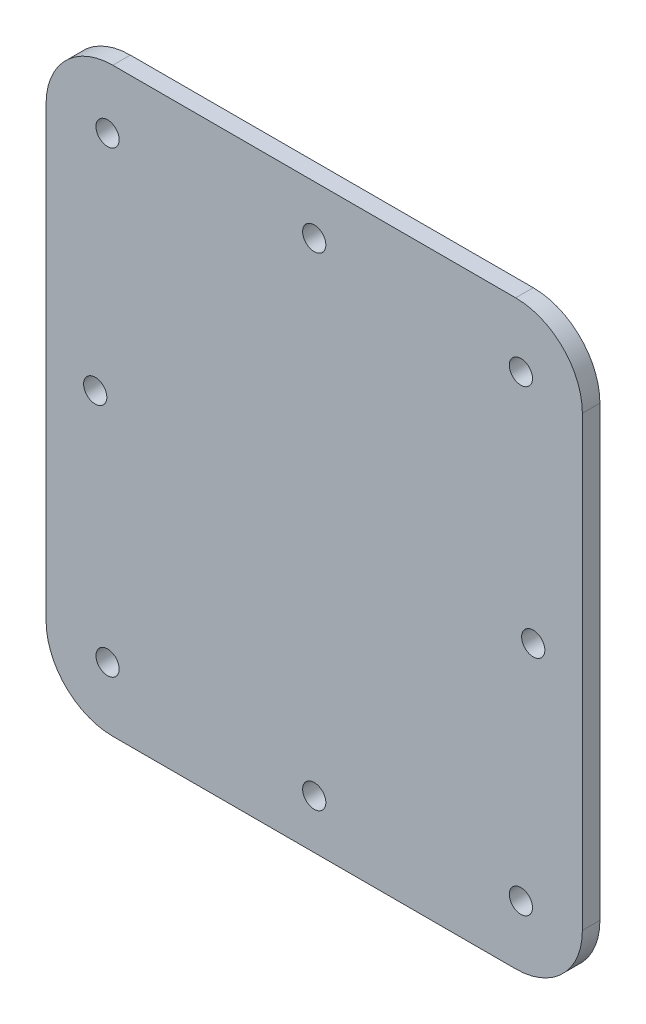
from build123d import *

# Parameters (mm, degrees)
SKETCH1_R           = 2.1
BOSS_EXTRUDE1_DEPTH = 3.175


with BuildPart() as part:
    # Sketch1 → Boss-Extrude1 (new body)
    with BuildSketch(Plane.XY):
        with BuildLine():
            Line((88.518997498, 156.463994751), (15.620999985, 156.463994751))
            ThreePointArc((15.620999985, 156.463994751), (7.08975667, 152.930238066), (3.555999985, 144.398994751))
            Line((3.555999985, 144.398994751), (3.555999985, 63.373000793))
            ThreePointArc((3.555999985, 63.373000793), (7.08975667, 54.841757478), (15.620999985, 51.308000793))
            Line((15.620999985, 51.308000793), (88.518997498, 51.308000793))
            ThreePointArc((88.518997498, 51.308000793), (97.050240813, 54.841757478), (100.583997498, 63.373000793))
            Line((100.583997498, 63.373000793), (100.583997498, 144.398994751))
            ThreePointArc((100.583997498, 144.398994751), (97.050240813, 152.930238066), (88.518997498, 156.463994751))
        make_face()
        with Locations((14.677846312, 145.342148424)):
            Circle(SKETCH1_R, mode=Mode.SUBTRACT)
        with Locations((52.069998741, 147.573994751)):
            Circle(SKETCH1_R, mode=Mode.SUBTRACT)
        with Locations((89.46215117, 145.342148424)):
            Circle(SKETCH1_R, mode=Mode.SUBTRACT)
        with Locations((91.693997498, 103.885997772)):
            Circle(SKETCH1_R, mode=Mode.SUBTRACT)
        with Locations((89.46215117, 62.429847121)):
            Circle(SKETCH1_R, mode=Mode.SUBTRACT)
        with Locations((52.069998741, 60.198000793)):
            Circle(SKETCH1_R, mode=Mode.SUBTRACT)
        with Locations((14.677846312, 62.429847121)):
            Circle(SKETCH1_R, mode=Mode.SUBTRACT)
        with Locations((12.445999985, 103.885997772)):
            Circle(SKETCH1_R, mode=Mode.SUBTRACT)
    extrude(amount=BOSS_EXTRUDE1_DEPTH)


solid = part.part
